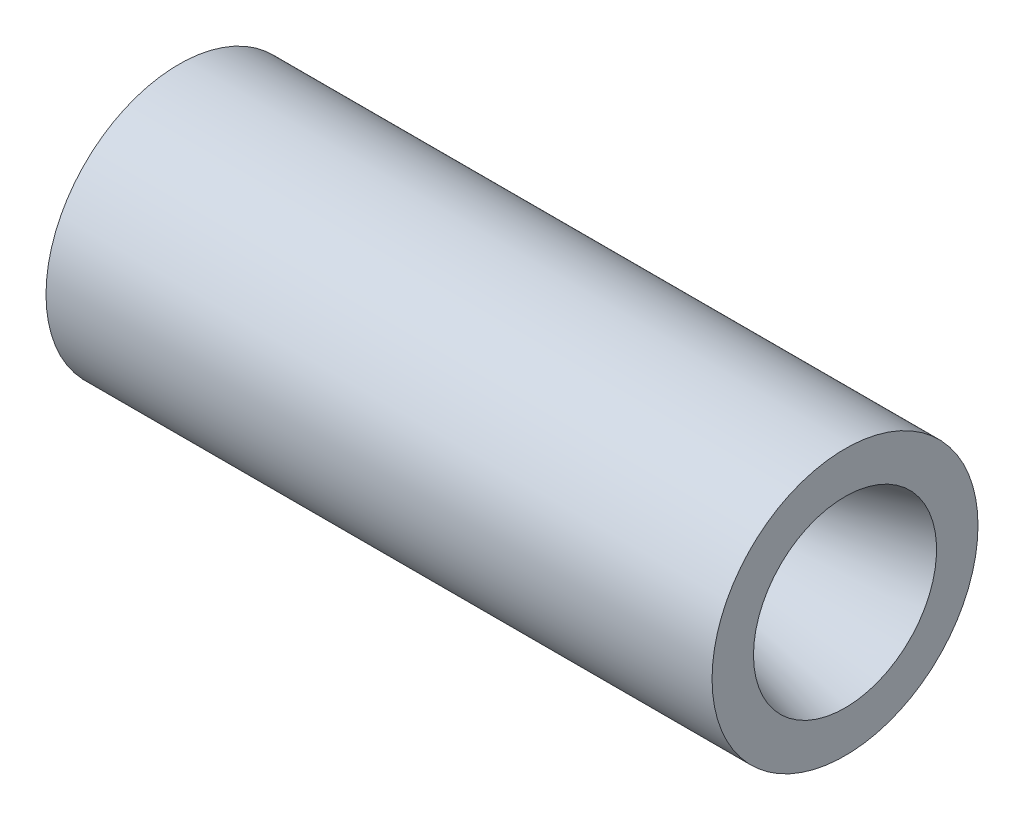
from build123d import *


with BuildPart() as part:
    # Sketch1 → Revolve1 (revolve)
    with BuildSketch(Plane.XY, mode=Mode.PRIVATE) as revolve1_sk:
        with BuildLine():
            Line((0, 53.34), (267.174285764, 53.34))
            Line((267.174285764, 53.34), (267.174285764, 36.7237391))
            Line((267.174285764, 36.7237391), (195.627584968, 17.5528584))
            ThreePointArc((195.627584968, 17.5528584), (188.286684173, 17.23234775), (181.498114964, 20.044265185))
            Line((181.498114964, 20.044265185), (152.703069528, 40.206773063))
            ThreePointArc((152.703069528, 40.206773063), (148.071235785, 42.490940687), (142.96691498, 43.2765708))
            Line((142.96691498, 43.2765708), (0, 43.2765708))
            Line((0, 43.2765708), (0, 53.34))
        make_face()
    revolve(revolve1_sk.sketch.rotate(Axis((0, 0, 0), (1, 0, 0)), 90), axis=Axis((0, 0, 0), (1, 0, 0)))


solid = part.part
